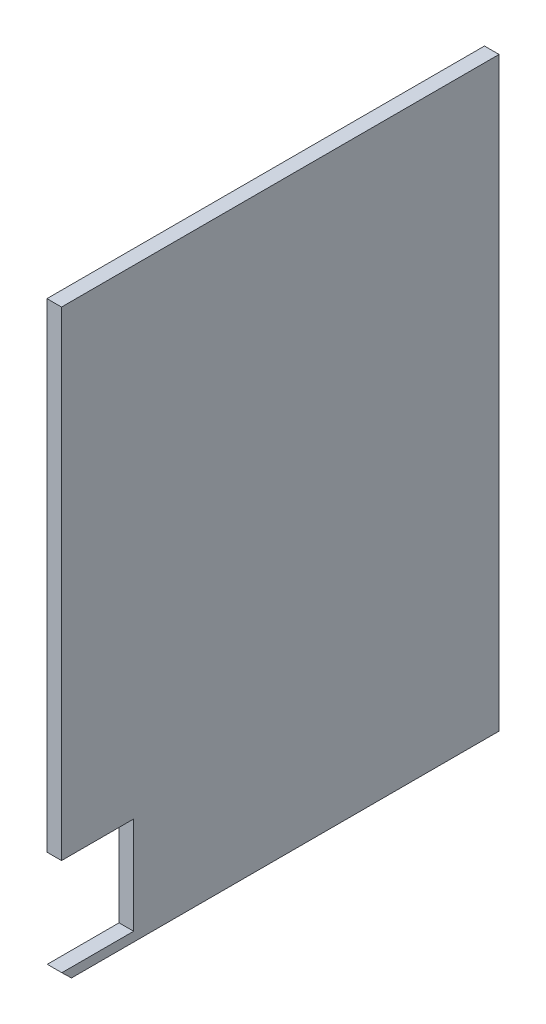
from build123d import *

# Parameters (mm, degrees)
BOSS_EXTRUDE1_DEPTH = 6


with BuildPart() as part:
    # Sketch1 → Boss-Extrude1 (new body)
    with BuildSketch(Plane.YZ):
        Polygon((211.64524763, 505.119316824), (211.64524763, 325.119316824), (-29.444380918, 325.119316824), (-29.444380918, 501.026117873), (-25.579182926, 504.989741782), (-25.579182926, 475.450700315), (14.420817074, 475.450700315), (14.420817074, 505.119316824), (151, 505.119316824), align=None)
    extrude(amount=BOSS_EXTRUDE1_DEPTH)


solid = part.part
